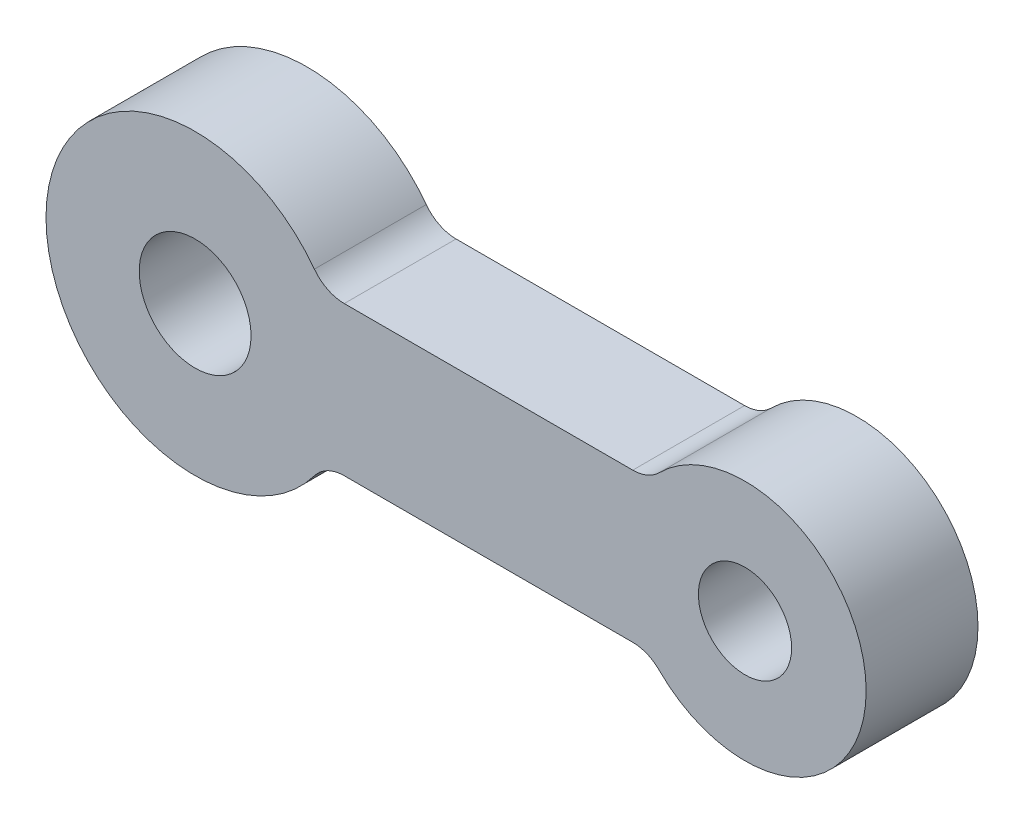
from build123d import *

# Parameters (mm, degrees)
ESQUISSE1_R        = 3
ESQUISSE1_R_2      = 2.5
BOSS_EXTRU_1_DEPTH = 6
CONG_1_R           = 2


with BuildPart() as part:
    # Esquisse1 → Boss.-Extru.1 (new body)
    with BuildSketch(Plane.XY):
        with BuildLine():
            Line((6.92820323, 4), (24.376524617, 4))
            ThreePointArc((24.376524617, 4), (36, 0), (24.376524617, -4))
            Line((24.376524617, -4), (6.92820323, -4))
            ThreePointArc((6.92820323, -4), (-8, 0), (6.92820323, 4))
        make_face()
        Circle(ESQUISSE1_R, mode=Mode.SUBTRACT)
        with Locations((29.5, 0)):
            Circle(ESQUISSE1_R_2, mode=Mode.SUBTRACT)
    extrude(amount=BOSS_EXTRU_1_DEPTH)

    # Congé1
    cong_1_edges = [part.edges().sort_by_distance(p)[0] for p in [
        (6.92820323, 4, 3),
        (24.376524617, 4, 3),
        (24.376524617, -4, 3),
        (6.92820323, -4, 3),
    ]]
    fillet(cong_1_edges, radius=CONG_1_R)


solid = part.part
